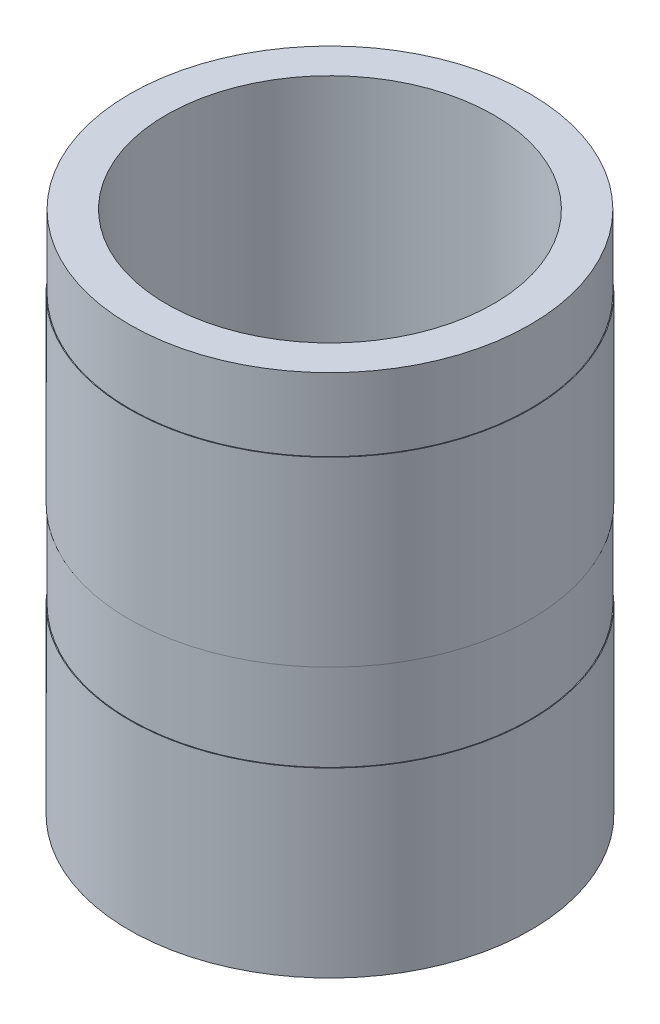
from build123d import *

# Parameters (mm, degrees)
SKETCH1_W   = 5
SKETCH1_H   = 72
SKETCH1_W_2 = 0.1
SKETCH1_H_2 = 25


with BuildPart() as part:
    # Sketch1 → Revolve1 (revolve)
    with BuildSketch(Plane.XY, mode=Mode.PRIVATE) as revolve1_sk:
        with Locations((25, 36)):
            Rectangle(SKETCH1_W, SKETCH1_H)
        with Locations((27.55, 49.5)):
            Rectangle(SKETCH1_W_2, SKETCH1_H_2)
        with Locations((27.55, 12.5)):
            Rectangle(SKETCH1_W_2, SKETCH1_H_2)
    revolve(revolve1_sk.sketch.rotate(Axis((0, 0, 0), (0, 1, 0)), 90), axis=Axis((0, 0, 0), (0, 1, 0)))


solid = part.part
